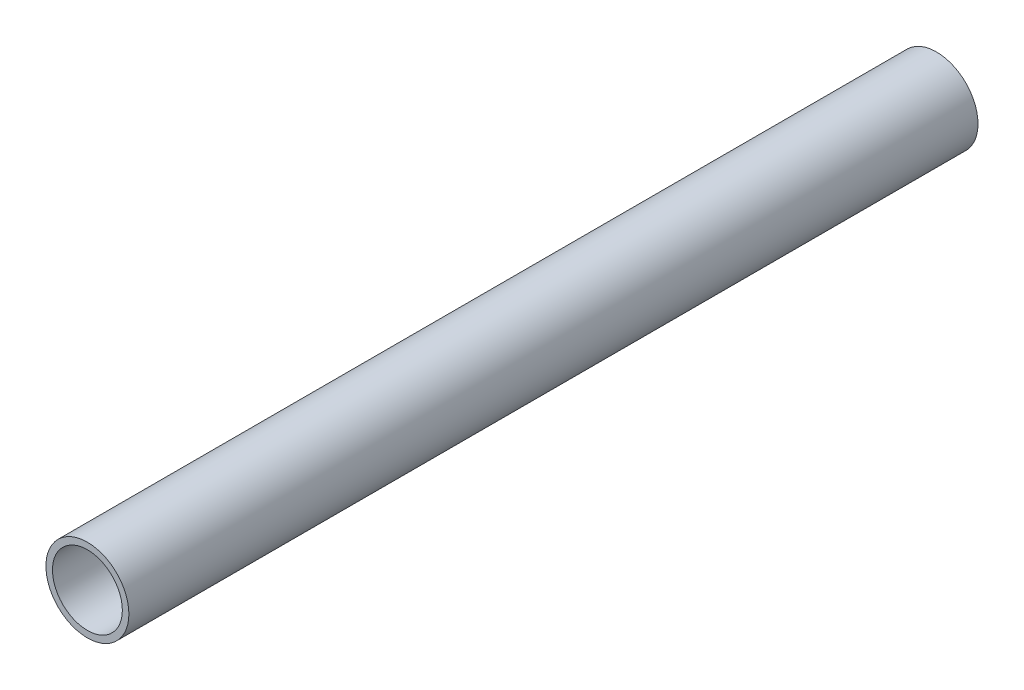
from build123d import *

# Parameters (mm, degrees)
ESBO_O2_R                = 12.7
ESBO_O2_R_2              = 10.7
RESSALTO_EXTRUS_O1_DEPTH = 260


with BuildPart() as part:
    # Esboço2 → Ressalto-extrusão1 (new body)
    with BuildSketch(Plane.XY):
        Circle(ESBO_O2_R)
        Circle(ESBO_O2_R_2, mode=Mode.SUBTRACT)
    extrude(amount=RESSALTO_EXTRUS_O1_DEPTH)


solid = part.part
